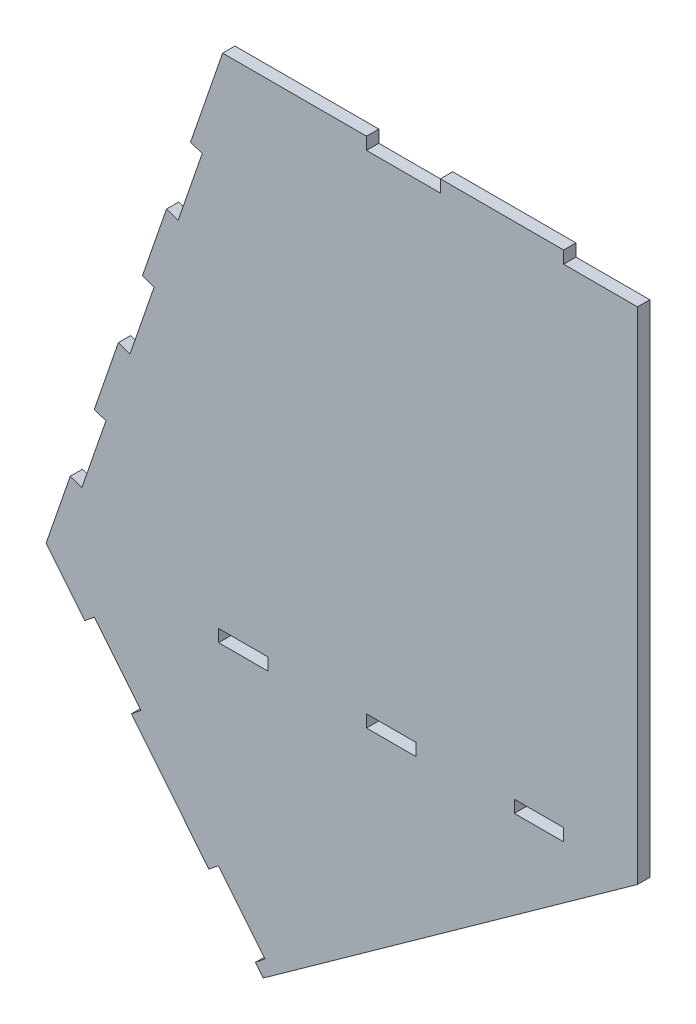
from build123d import *

# Parameters (mm, degrees)
SKETCH1_W           = 12.7
SKETCH1_H           = 3.175
BOSS_EXTRUDE1_DEPTH = 3.175


with BuildPart() as part:
    # Sketch1 → Boss-Extrude1 (new body)
    with BuildSketch(Plane.XY):
        Polygon((152.4, 0), (152.4, 128.913945011), (133.35, 128.913945011), (133.35, 132.088945011), (101.6, 132.088945011), (101.6, 128.913945011), (82.55, 128.913945011), (82.55, 132.088945011), (45.481871178, 132.088945011), (37.212440054, 108.072773191), (40.214461532, 107.039094301), (34.01238819, 89.026965435), (31.010366712, 90.060644326), (24.80829337, 72.048515461), (27.810314847, 71.01483657), (21.608241505, 53.002707705), (18.606220027, 54.036386596), (12.404146685, 36.02425773), (15.406168162, 34.99057884), (9.20409482, 16.978449975), (6.202073342, 18.012128865), (0, 0), (9.97035014, -12.312357038), (12.437788568, -10.314264796), (24.426342017, -25.118895362), (21.95890359, -27.116987604), (41.939826006, -51.79137188), (44.407264433, -49.793279638), (56.395817883, -64.597910204), (53.928379455, -66.596002446), (55.946582764, -69.088275974), align=None)
        with Locations((88.9, 1.5875)):
            Rectangle(SKETCH1_W, SKETCH1_H, mode=Mode.SUBTRACT)
        with Locations((127, 1.5875)):
            Rectangle(SKETCH1_W, SKETCH1_H, mode=Mode.SUBTRACT)
        with Locations((50.8, 1.5875)):
            Rectangle(SKETCH1_W, SKETCH1_H, mode=Mode.SUBTRACT)
    extrude(amount=BOSS_EXTRUDE1_DEPTH)


solid = part.part
